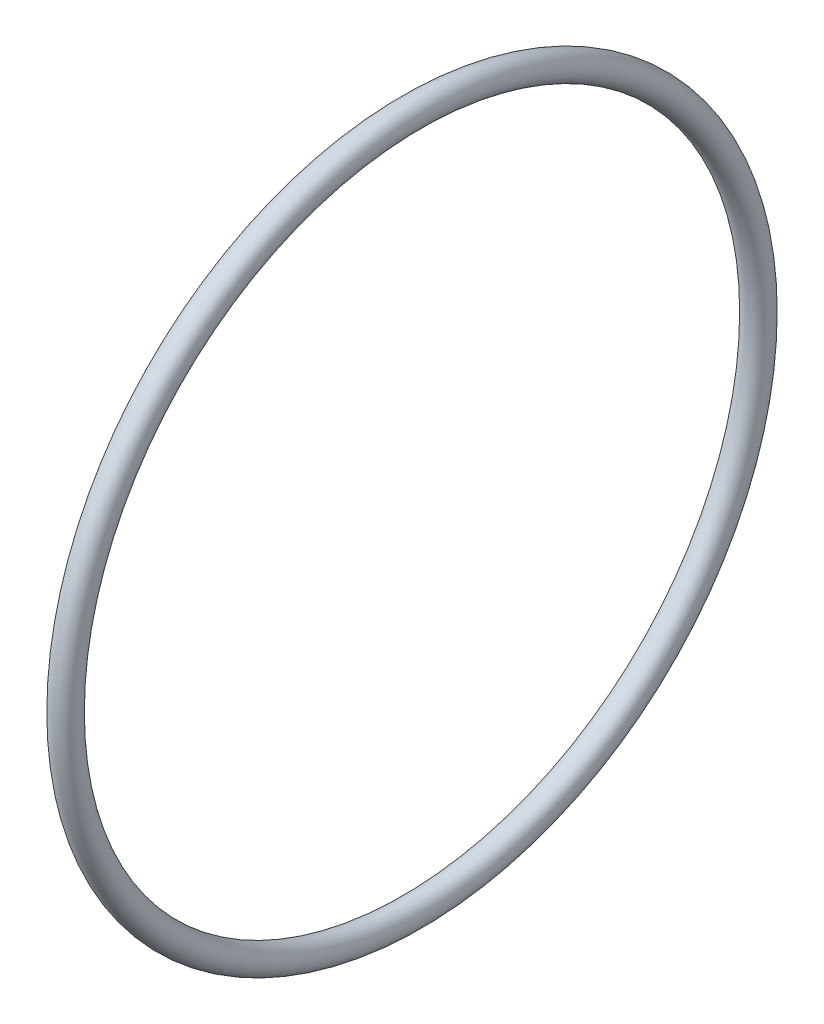
from build123d import *

# Parameters (mm, degrees)
SWEEP1_PROFILE_R = 1.5875


with BuildPart() as part:
    # Sweep1: sweep along a path in Sketch1
    with BuildLine(Plane(origin=(0, 0, 0), x_dir=(0, 0, -1), z_dir=(1, 0, 0))) as sweep1_path:
        CenterArc((0, 0), 41.402, 0, 360)
    # Sweep1 profile (on start of the path) → Sweep1 (sweep)
    with BuildSketch(Plane(origin=(0, 0, -41.402), x_dir=(0, 0, 1), z_dir=(0, 1, 0))):
        Circle(SWEEP1_PROFILE_R)
    sweep(path=sweep1_path.line)


solid = part.part
